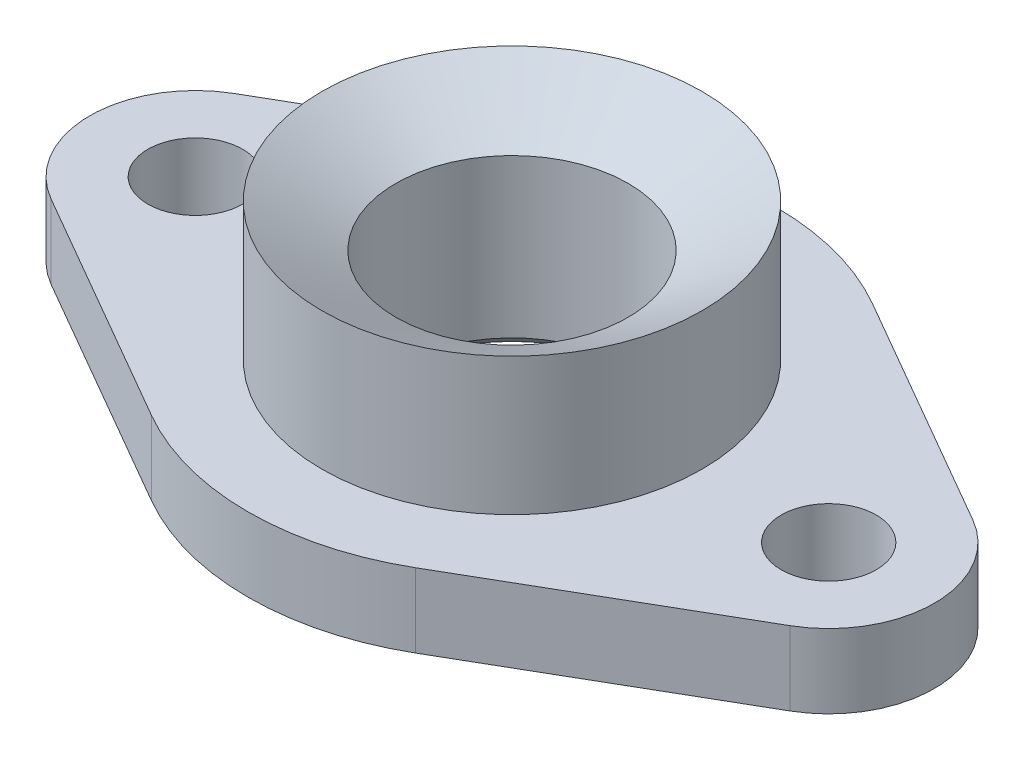
from build123d import *

# Parameters (mm, degrees)
SKETCH_2_R      = 4.5
EXTRUDE_1_DEPTH = 7
SKETCH_3_R      = 18
EXTRUDE_2_DEPTH = 13
CHAMFER_1_SIZE  = 1


with BuildPart() as part:
    # 草图2 → 拉伸1 (new body)
    with BuildSketch(Plane(origin=(0, 0, 0), x_dir=(1, 0, 0), z_dir=(0, 1, 0))):
        with BuildLine():
            Line((-12.5, 21.650635095), (-35, 8.660254038))
            ThreePointArc((-35, 8.660254038), (-40, 0), (-35, -8.660254038))
            Line((-35, -8.660254038), (-12.5, -21.650635095))
            ThreePointArc((-12.5, -21.650635095), (0, -25), (12.5, -21.650635095))
            Line((12.5, -21.650635095), (35, -8.660254038))
            ThreePointArc((35, -8.660254038), (40, 0), (35, 8.660254038))
            Line((35, 8.660254038), (12.5, 21.650635095))
            ThreePointArc((12.5, 21.650635095), (0, 25), (-12.5, 21.650635095))
        make_face()
        with Locations(Location((-30, 0, 0), (0, 0, 270))):
            Circle(SKETCH_2_R, mode=Mode.SUBTRACT)
        with Locations(Location((30, 0, 0), (0, 0, 270))):
            Circle(SKETCH_2_R, mode=Mode.SUBTRACT)
    extrude(amount=EXTRUDE_1_DEPTH)

    # 草图3 → 拉伸2 (add)
    with BuildSketch(Plane(origin=(0, 7, 0), x_dir=(1, 0, 0), z_dir=(0, 1, 0))):
        with Locations(Location((0, 0, 0), (0, 0, 90))):
            Circle(SKETCH_3_R)
    extrude(amount=EXTRUDE_2_DEPTH)

    # 草图4 → 切除-旋转2 (revolve, cut)
    with BuildSketch(Plane(origin=(0, 20, 0), x_dir=(1, 0, 0), z_dir=(0, 0, -1)), mode=Mode.PRIVATE) as cut_revolve_2_sk:
        Polygon((0, 20), (11, 20), (11, 4.041451884), (18, 0), (0, 0), align=None)
    revolve(cut_revolve_2_sk.sketch.rotate(Axis((0, -9.575798304, 0), (0, 1, 0)), 90), axis=Axis((0, -9.575798304, 0), (0, 1, 0)), mode=Mode.SUBTRACT)

    # 倒角1
    chamfer_1_edges = [part.edges().sort_by_distance(p)[0] for p in [
        (0, 0, 11),
    ]]
    chamfer(chamfer_1_edges, length=CHAMFER_1_SIZE)


solid = part.part
